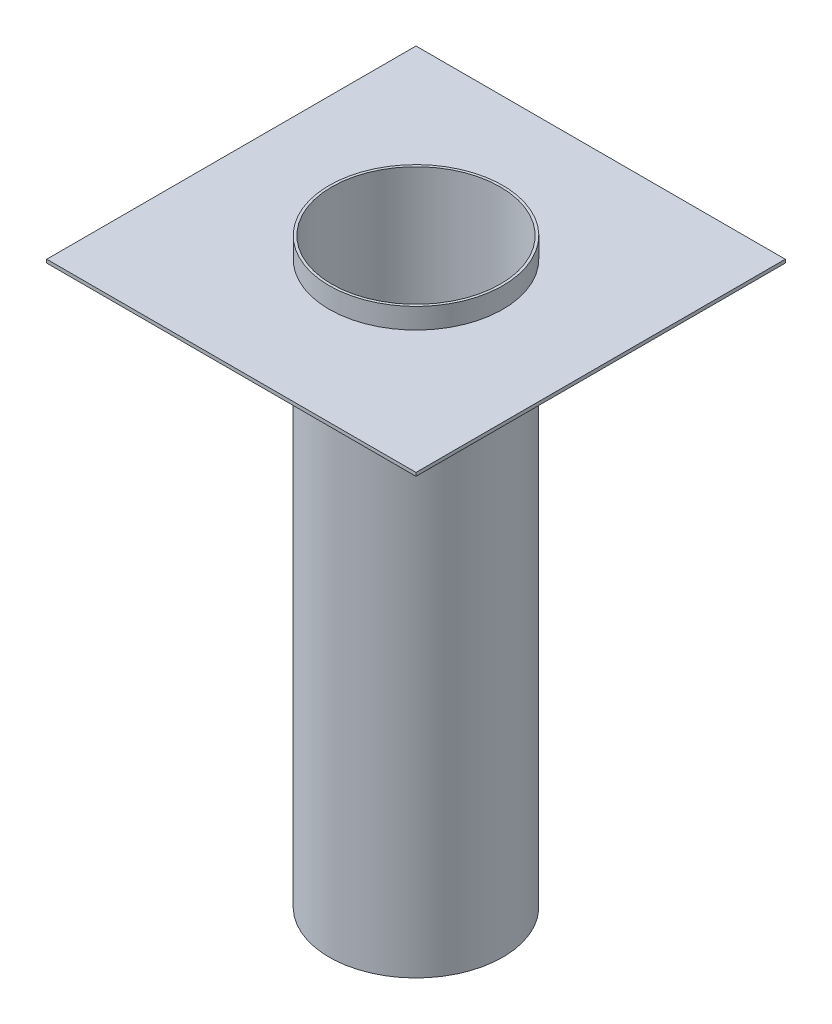
from build123d import *

# Parameters (mm, degrees)
SKETCH1_W           = 108
SKETCH1_H           = 108
BOSS_EXTRUDE1_DEPTH = 170.1
SKETCH2_OUTSIDE_W   = 155.722
SKETCH2_OUTSIDE_H   = 155.722
SKETCH2_OUTSIDE_R   = 25.4
CUT_EXTRUDE1_DEPTH  = 6
SKETCH3_OUTSIDE_W   = 155.722
SKETCH3_OUTSIDE_H   = 155.722
SKETCH3_OUTSIDE_R   = 25.4
CUT_EXTRUDE3_DEPTH  = 163.1
SKETCH5_R           = 24.65
CUT_EXTRUDE4_DEPTH  = 187.456456043


with BuildPart() as part:
    # Sketch1 → Boss-Extrude1 (new body)
    with BuildSketch(Plane(origin=(0, 0, 0), x_dir=(1, 0, 0), z_dir=(0, 1, 0))):
        Rectangle(SKETCH1_W, SKETCH1_H)
    extrude(amount=BOSS_EXTRUDE1_DEPTH)

    # Sketch2 outside → Cut-Extrude1 (cut)
    with BuildSketch(Plane(origin=(0, 170.1, 0), x_dir=(1, 0, 0), z_dir=(0, 1, 0))):
        Rectangle(SKETCH2_OUTSIDE_W, SKETCH2_OUTSIDE_H)
        with Locations(Location((0, 0, 0), (0, 0, 270))):
            Circle(SKETCH2_OUTSIDE_R, mode=Mode.SUBTRACT)
    extrude(amount=-CUT_EXTRUDE1_DEPTH, mode=Mode.SUBTRACT)

    # Sketch3 outside → Cut-Extrude3 (cut)
    with BuildSketch(Plane.XZ):
        Rectangle(SKETCH3_OUTSIDE_W, SKETCH3_OUTSIDE_H)
        with Locations(Location((0, 0, 0), (0, 0, 90))):
            Circle(SKETCH3_OUTSIDE_R, mode=Mode.SUBTRACT)
    extrude(amount=-CUT_EXTRUDE3_DEPTH, mode=Mode.SUBTRACT)

    # Sketch5 → Cut-Extrude4 (cut, through all)
    with BuildSketch(Plane.XZ):
        with Locations(Location((0, 0, 0), (0, 0, 270))):
            Circle(SKETCH5_R)
    extrude(amount=-CUT_EXTRUDE4_DEPTH, mode=Mode.SUBTRACT)


solid = part.part
